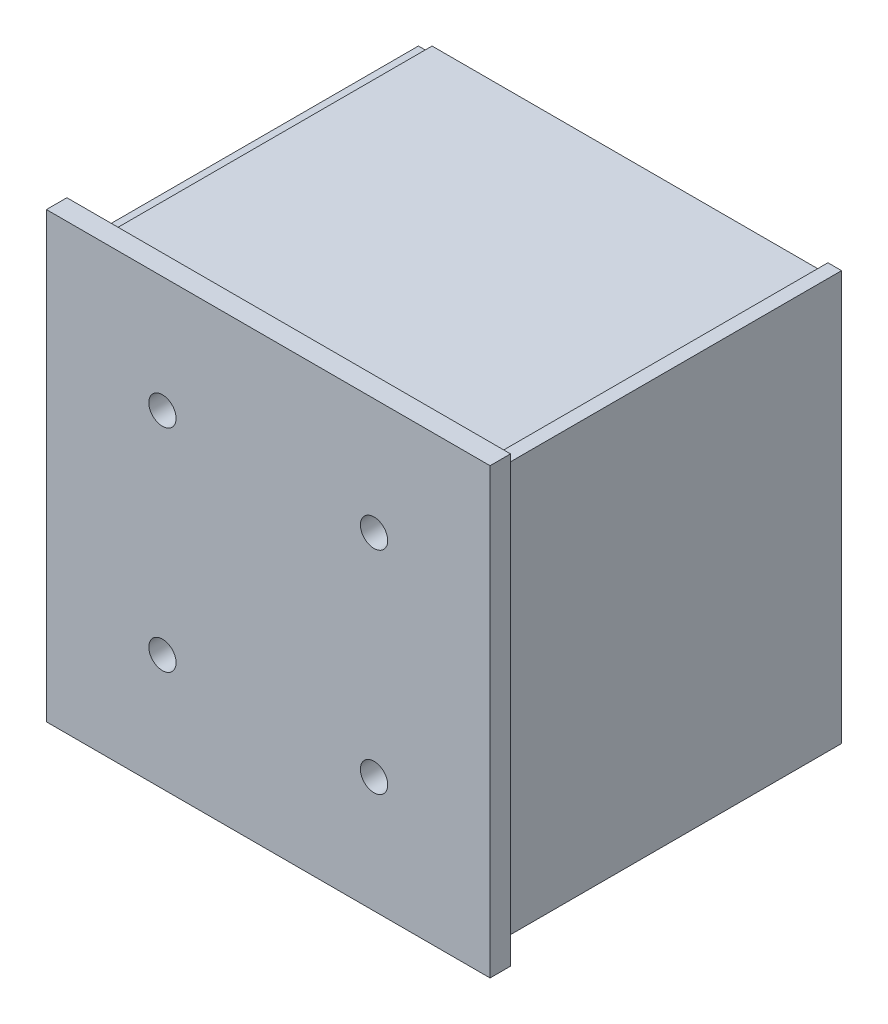
from build123d import *

# Parameters (mm, degrees)
SKETCH1_W           = 65
SKETCH1_H           = 65
SKETCH1_R           = 2
BOSS_EXTRUDE1_DEPTH = 3
SKETCH4_W           = 2
SKETCH4_H           = 60
SKETCH4_H_2         = 55
BOSS_EXTRUDE3_DEPTH = 50


with BuildPart() as part:
    # Sketch1 → Boss-Extrude1 (new body)
    with BuildSketch(Plane.XY):
        Rectangle(SKETCH1_W, SKETCH1_H)
        with Locations((-15.5, 15.5)):
            Circle(SKETCH1_R, mode=Mode.SUBTRACT)
        with Locations((15.5, 15.5)):
            Circle(SKETCH1_R, mode=Mode.SUBTRACT)
        with Locations((15.5, -15.5)):
            Circle(SKETCH1_R, mode=Mode.SUBTRACT)
        with Locations((-15.5, -15.5)):
            Circle(SKETCH1_R, mode=Mode.SUBTRACT)
    extrude(amount=BOSS_EXTRUDE1_DEPTH)

    # Sketch4 → Boss-Extrude3 (add)
    with BuildSketch(Plane(origin=(0, 0, 0), x_dir=(-1, 0, 0), z_dir=(0, 0, -1))):
        with Locations((-30, 0)):
            Rectangle(SKETCH4_W, SKETCH4_H)
        Polygon((29, -26.5), (-29, -26.5), (-29, -28.5), (29, -28.5), (29, -27.5), align=None)
        with Locations((30, 0)):
            Rectangle(SKETCH4_W, SKETCH4_H_2)
        Polygon((29, 27.5), (29, 28.5), (-29, 28.5), (-29, 26.5), (29, 26.5), align=None)
    extrude(amount=BOSS_EXTRUDE3_DEPTH)


solid = part.part
